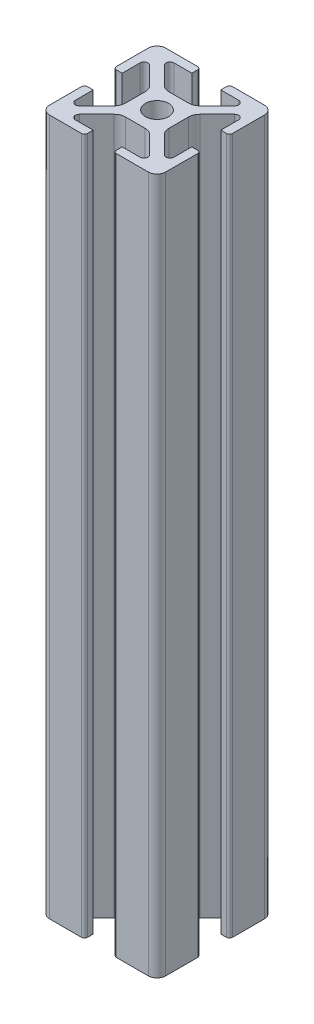
from build123d import *

# Parameters (mm, degrees)
ESQUISSE1_R        = 2
BOSS_EXTRU_1_DEPTH = 120


with BuildPart() as part:
    # Esquisse1 → Boss.-Extru.1 (new body)
    with BuildSketch(Plane(origin=(0, 0, 0), x_dir=(1, 0, 0), z_dir=(0, 1, 0))):
        with BuildLine():
            Line((-5.649708969, 9.692729836), (-5.649708969, 4.192729836))
            ThreePointArc((-5.649708969, 4.192729836), (-5.503262359, 3.839176445), (-5.149708969, 3.692729836))
            Line((-5.149708969, 3.692729836), (-4.149708969, 3.692729836))
            Line((-4.149708969, 3.692729836), (-4.149708969, 6.752780342))
            ThreePointArc((-4.149708969, 6.752780342), (-3.717587371, 7.399496015), (-2.954734222, 7.247755089))
            Line((-2.954734222, 7.247755089), (0.014504594, 4.278516274))
            ThreePointArc((0.014504594, 4.278516274), (0.448050096, 3.629669576), (0.600291031, 2.864302711))
            Line((0.600291031, 2.864302711), (0.600291031, -0.478843039))
            ThreePointArc((0.600291031, -0.478843039), (0.448050096, -1.244209904), (0.014504594, -1.893056602))
            Line((0.014504594, -1.893056602), (-2.954734222, -4.862295417))
            ThreePointArc((-2.954734222, -4.862295417), (-3.717587371, -5.014036343), (-4.149708969, -4.36732067))
            Line((-4.149708969, -4.36732067), (-4.149708969, -1.307270164))
            Line((-4.149708969, -1.307270164), (-5.149708969, -1.307270164))
            ThreePointArc((-5.149708969, -1.307270164), (-5.503262359, -1.453716774), (-5.649708969, -1.807270164))
            Line((-5.649708969, -1.807270164), (-5.649708969, -7.307270164))
            ThreePointArc((-5.649708969, -7.307270164), (-5.21036914, -8.367930336), (-4.149708969, -8.807270164))
            Line((-4.149708969, -8.807270164), (1.350291031, -8.807270164))
            ThreePointArc((1.350291031, -8.807270164), (1.703844422, -8.660823555), (1.850291031, -8.307270164))
            Line((1.850291031, -8.307270164), (1.850291031, -7.307270164))
            Line((1.850291031, -7.307270164), (-1.209759475, -7.307270164))
            ThreePointArc((-1.209759475, -7.307270164), (-1.856475148, -6.875148567), (-1.704734222, -6.112295417))
            Line((-1.704734222, -6.112295417), (1.264504594, -3.143056602))
            ThreePointArc((1.264504594, -3.143056602), (1.913351291, -2.709511099), (2.678718156, -2.557270164))
            Line((2.678718156, -2.557270164), (6.021863907, -2.557270164))
            ThreePointArc((6.021863907, -2.557270164), (6.787230771, -2.709511099), (7.436077469, -3.143056602))
            Line((7.436077469, -3.143056602), (10.405316285, -6.112295417))
            ThreePointArc((10.405316285, -6.112295417), (10.557057211, -6.875148567), (9.910341538, -7.307270164))
            Line((9.910341538, -7.307270164), (6.850291031, -7.307270164))
            Line((6.850291031, -7.307270164), (6.850291031, -8.307270164))
            ThreePointArc((6.850291031, -8.307270164), (6.996737641, -8.660823555), (7.350291031, -8.807270164))
            Line((7.350291031, -8.807270164), (12.850291031, -8.807270164))
            ThreePointArc((12.850291031, -8.807270164), (13.910951203, -8.367930336), (14.350291031, -7.307270164))
            Line((14.350291031, -7.307270164), (14.350291031, -1.807270164))
            ThreePointArc((14.350291031, -1.807270164), (14.203844422, -1.453716774), (13.850291031, -1.307270164))
            Line((13.850291031, -1.307270164), (12.850291031, -1.307270164))
            Line((12.850291031, -1.307270164), (12.850291031, -4.36732067))
            ThreePointArc((12.850291031, -4.36732067), (12.418169434, -5.014036343), (11.655316285, -4.862295417))
            Line((11.655316285, -4.862295417), (8.686077469, -1.893056602))
            ThreePointArc((8.686077469, -1.893056602), (8.252531966, -1.244209904), (8.100291031, -0.478843039))
            Line((8.100291031, -0.478843039), (8.100291031, 2.864302711))
            ThreePointArc((8.100291031, 2.864302711), (8.252531966, 3.629669576), (8.686077469, 4.278516274))
            Line((8.686077469, 4.278516274), (11.655316285, 7.247755089))
            ThreePointArc((11.655316285, 7.247755089), (12.418169434, 7.399496015), (12.850291031, 6.752780342))
            Line((12.850291031, 6.752780342), (12.850291031, 3.692729836))
            Line((12.850291031, 3.692729836), (13.850291031, 3.692729836))
            ThreePointArc((13.850291031, 3.692729836), (14.203844422, 3.839176445), (14.350291031, 4.192729836))
            Line((14.350291031, 4.192729836), (14.350291031, 9.692729836))
            ThreePointArc((14.350291031, 9.692729836), (13.910951203, 10.753390008), (12.850291031, 11.192729836))
            Line((12.850291031, 11.192729836), (7.350291031, 11.192729836))
            ThreePointArc((7.350291031, 11.192729836), (6.996737641, 11.046283226), (6.850291031, 10.692729836))
            Line((6.850291031, 10.692729836), (6.850291031, 9.692729836))
            Line((6.850291031, 9.692729836), (9.910341538, 9.692729836))
            ThreePointArc((9.910341538, 9.692729836), (10.557057211, 9.260608239), (10.405316285, 8.497755089))
            Line((10.405316285, 8.497755089), (7.436077469, 5.528516274))
            ThreePointArc((7.436077469, 5.528516274), (6.787230771, 5.094970771), (6.021863907, 4.942729836))
            Line((6.021863907, 4.942729836), (2.678718156, 4.942729836))
            ThreePointArc((2.678718156, 4.942729836), (1.913351291, 5.094970771), (1.264504594, 5.528516274))
            Line((1.264504594, 5.528516274), (-1.704734222, 8.497755089))
            ThreePointArc((-1.704734222, 8.497755089), (-1.856475148, 9.260608239), (-1.209759475, 9.692729836))
            Line((-1.209759475, 9.692729836), (1.850291031, 9.692729836))
            Line((1.850291031, 9.692729836), (1.850291031, 10.692729836))
            ThreePointArc((1.850291031, 10.692729836), (1.703844422, 11.046283226), (1.350291031, 11.192729836))
            Line((1.350291031, 11.192729836), (-4.149708969, 11.192729836))
            ThreePointArc((-4.149708969, 11.192729836), (-5.21036914, 10.753390008), (-5.649708969, 9.692729836))
        make_face()
        with Locations(Location((4.350291031, 1.192729836, 0), (0, 0, 270))):
            Circle(ESQUISSE1_R, mode=Mode.SUBTRACT)
    extrude(amount=BOSS_EXTRU_1_DEPTH)


solid = part.part
